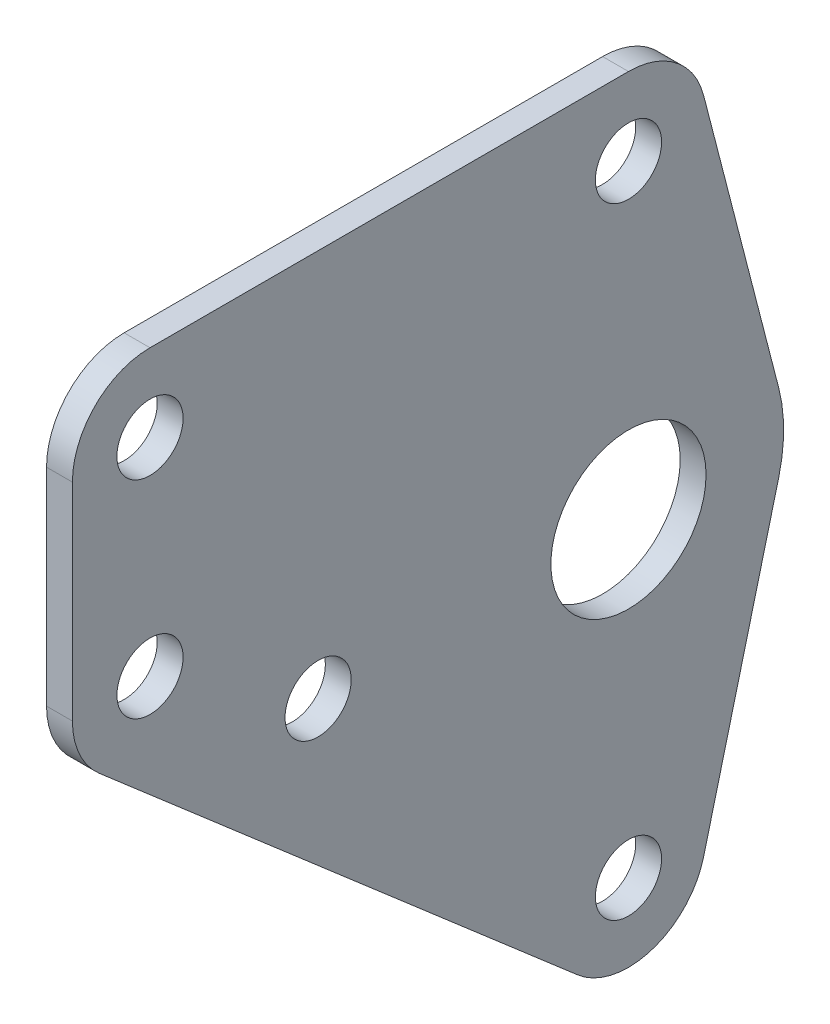
from build123d import *

# Parameters (mm, degrees)
SKETCH1_R           = 4.7625
SKETCH1_R_2         = 2.032
BOSS_EXTRUDE1_DEPTH = 1.5875
BOSS_EXTRUDE2_START = -1.5875
SKETCH2_R           = 2.032
BOSS_EXTRUDE2_DEPTH = 1.5875


with BuildPart() as part:
    # Sketch1 → Boss-Extrude1 (new body)
    with BuildSketch(Plane(origin=(0, 0, 0), x_dir=(0, 0, -1), z_dir=(1, 0, 0))):
        with BuildLine():
            Line((-3.367596045, 22.417596045), (-22.417596045, 3.367596045))
            ThreePointArc((-22.417596045, 3.367596045), (-23.8125, 0), (-22.417596045, -3.367596045))
            Line((-22.417596045, -3.367596045), (-3.367596045, -22.417596045))
            ThreePointArc((-3.367596045, -22.417596045), (1.253587833, -23.64455371), (4.611270797, -20.240625))
            Line((4.611270797, -20.240625), (9.222541593, -2.38125))
            ThreePointArc((9.222541593, -2.38125), (9.525, 0), (9.222541593, 2.38125))
            Line((9.222541593, 2.38125), (4.611270797, 20.240625))
            ThreePointArc((4.611270797, 20.240625), (1.253587833, 23.64455371), (-3.367596045, 22.417596045))
        make_face()
        Circle(SKETCH1_R, mode=Mode.SUBTRACT)
        with Locations((0, 19.05)):
            Circle(SKETCH1_R_2, mode=Mode.SUBTRACT)
        with Locations((-19.05, 0)):
            Circle(SKETCH1_R_2, mode=Mode.SUBTRACT)
        with Locations((0, -19.05)):
            Circle(SKETCH1_R_2, mode=Mode.SUBTRACT)
    extrude(amount=BOSS_EXTRUDE1_DEPTH)

    # Sketch2 → Boss-Extrude2 (add)
    with BuildSketch(Plane(origin=(1.5875, 0, 0), x_dir=(0, 0, -1), z_dir=(1, 0, 0)).offset(BOSS_EXTRUDE2_START)):
        with BuildLine():
            Line((-3.115398581, -22.652179609), (-32.484148581, 2.747820391))
            ThreePointArc((-32.484148581, 2.747820391), (-33.699944523, 4.369555541), (-34.13125, 6.35))
            Line((-34.13125, 6.35), (-34.13125, 19.05))
            ThreePointArc((-34.13125, 19.05), (-32.736346045, 22.417596045), (-29.36875, 23.8125))
            Line((-29.36875, 23.8125), (0, 23.8125))
            ThreePointArc((0, 23.8125), (-1.822529847, 23.449976274), (-3.367596045, 22.417596045))
            Line((-3.367596045, 22.417596045), (-22.417596045, 3.367596045))
            ThreePointArc((-22.417596045, 3.367596045), (-23.8125, 0), (-22.417596045, -3.367596045))
            Line((-22.417596045, -3.367596045), (-3.367596045, -22.417596045))
            ThreePointArc((-3.367596045, -22.417596045), (-3.243618688, -22.537168487), (-3.115398581, -22.652179609))
        make_face()
        with Locations((-29.36875, 6.35)):
            Circle(SKETCH2_R, mode=Mode.SUBTRACT)
        with Locations((-29.36875, 19.05)):
            Circle(SKETCH2_R, mode=Mode.SUBTRACT)
    extrude(amount=BOSS_EXTRUDE2_DEPTH)


solid = part.part
